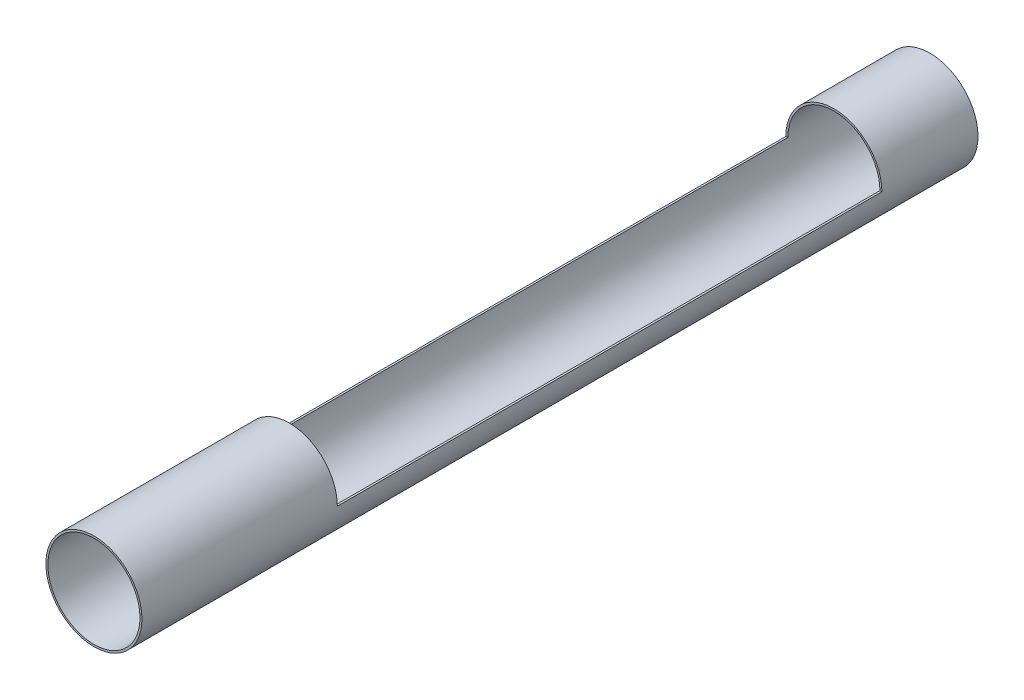
from build123d import *

# Parameters (mm, degrees)
SKETCH1_R           = 38.0746
SKETCH1_R_2         = 36.5125
BOSS_EXTRUDE1_DEPTH = 76.2
BOSS_EXTRUDE2_DEPTH = 431.8
SKETCH3_R           = 38.0746
SKETCH3_R_2         = 36.5125
BOSS_EXTRUDE3_DEPTH = 154.94


with BuildPart() as part:
    # Sketch1 → Boss-Extrude1 (new body)
    with BuildSketch(Plane.XY):
        with Locations(Location((0, 0, 0), (0, 0, 180))):
            Circle(SKETCH1_R)
        with Locations(Location((0, 0, 0), (0, 0, 180))):
            Circle(SKETCH1_R_2, mode=Mode.SUBTRACT)
    extrude(amount=BOSS_EXTRUDE1_DEPTH)

    # Sketch2 → Boss-Extrude2 (add)
    with BuildSketch(Plane.XY.offset(76.2)):
        with BuildLine():
            Line((-38.0746, 0), (-36.5125, 0))
            ThreePointArc((-36.5125, 0), (0, -36.5125), (36.5125, 0))
            Line((36.5125, 0), (38.0746, 0))
            ThreePointArc((38.0746, 0), (0, -38.0746), (-38.0746, 0))
        make_face()
    extrude(amount=BOSS_EXTRUDE2_DEPTH)

    # Sketch3 → Boss-Extrude3 (add)
    with BuildSketch(Plane.XY.offset(508)):
        Circle(SKETCH3_R)
        Circle(SKETCH3_R_2, mode=Mode.SUBTRACT)
    extrude(amount=BOSS_EXTRUDE3_DEPTH)


solid = part.part
